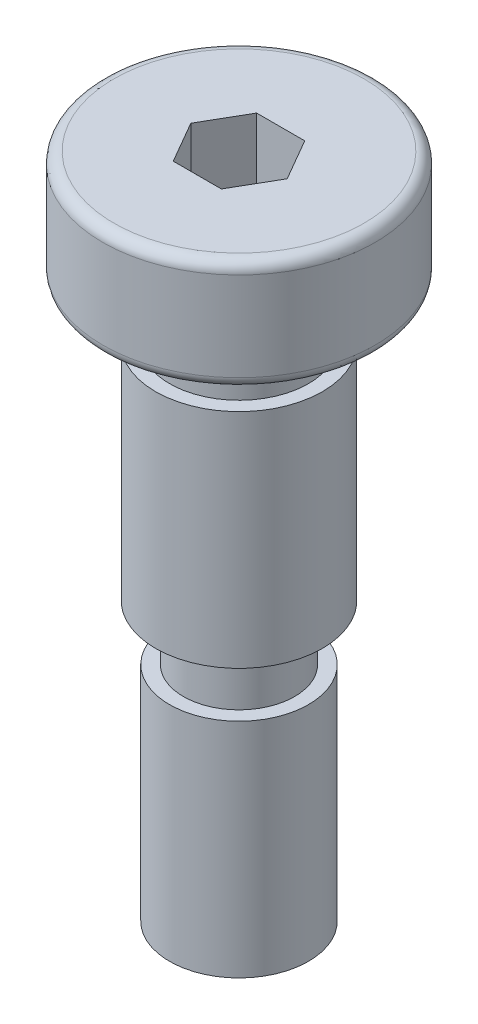
from build123d import *

# Parameters (mm, degrees)
CUT_EXTRUDE_1_DEPTH = 3.5


with BuildPart() as part:
    # 草图1 → 旋转1 (revolve)
    with BuildSketch(Plane.XY, mode=Mode.PRIVATE) as revolve_1_sk:
        with BuildLine():
            Line((0, 24), (-4.5, 24))
            ThreePointArc((-4.5, 24), (-4.782842712, 23.882842712), (-4.9, 23.6))
            Line((-4.9, 23.6), (-4.9, 20.4))
            ThreePointArc((-4.9, 20.4), (-4.782842712, 20.117157288), (-4.5, 20))
            Line((-4.5, 20), (-2.5, 20))
            Line((-2.5, 20), (-2.5, 18))
            Line((-2.5, 18), (-3, 18))
            Line((-3, 18), (-3, 10))
            Line((-3, 10), (-2, 10))
            Line((-2, 10), (-2, 8))
            Line((-2, 8), (-2.5, 8))
            Line((-2.5, 8), (-2.5, 0))
            Line((-2.5, 0), (0, 0))
            Line((0, 0), (0, 24))
        make_face()
    revolve(revolve_1_sk.sketch.rotate(Axis((0, 0, 0), (0, 1, 0)), 270), axis=Axis((0, 0, 0), (0, 1, 0)))

    # 草图2 → 切除-拉伸1 (cut)
    with BuildSketch(Plane(origin=(0, 24, 0), x_dir=(1, 0, 0), z_dir=(0, 1, 0))):
        Polygon((0.866025404, 1.5), (-0.866025404, 1.5), (-1.732050808, 0), (-0.866025404, -1.5), (0.866025404, -1.5), (1.732050808, 0), align=None)
    extrude(amount=-CUT_EXTRUDE_1_DEPTH, mode=Mode.SUBTRACT)


solid = part.part
